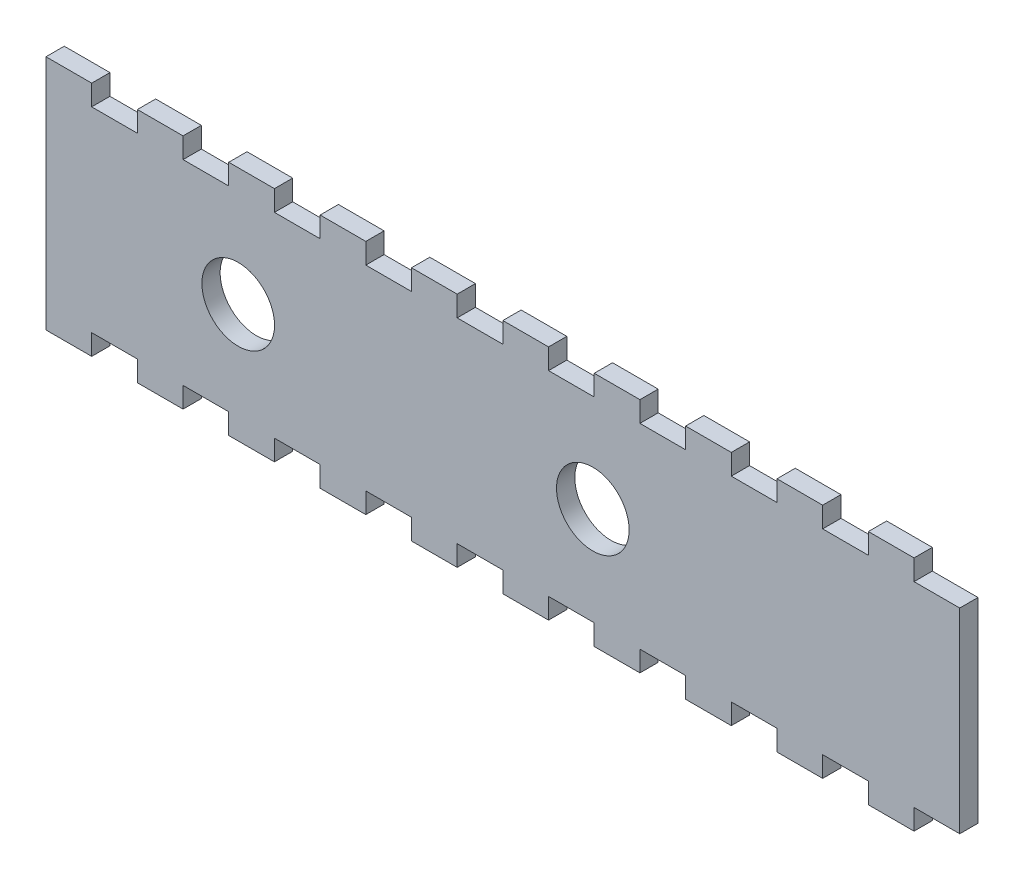
from build123d import *

# Parameters (mm, degrees)
SKETCH1_W           = 100
SKETCH1_H           = 21.4
SKETCH1_R           = 3.975
BOSS_EXTRUDE2_DEPTH = 2
SKETCH1_6_W         = 5
SKETCH1_6_H         = 2.25
BOSS_EXTRUDE4_DEPTH = 2


with BuildPart() as part:
    # Sketch1 → Boss-Extrude2 (new body)
    with BuildSketch(Plane.XY):
        with Locations((50, 10.7)):
            Rectangle(SKETCH1_W, SKETCH1_H)
        with Locations((59.844934973, 10.7)):
            Circle(SKETCH1_R, mode=Mode.SUBTRACT)
        with Locations((21.034934973, 10.7)):
            Circle(SKETCH1_R, mode=Mode.SUBTRACT)
    extrude(amount=BOSS_EXTRUDE2_DEPTH)

    # Sketch1<6> → Boss-Extrude4 (add)
    with BuildSketch(Plane.XY):
        with Locations((2.5, -1.125)):
            Rectangle(SKETCH1_6_W, SKETCH1_6_H)
        with Locations((2.5, 22.525)):
            Rectangle(SKETCH1_6_W, SKETCH1_6_H)
        with Locations((12.5, -1.125)):
            Rectangle(SKETCH1_6_W, SKETCH1_6_H)
        with Locations((12.5, 22.525)):
            Rectangle(SKETCH1_6_W, SKETCH1_6_H)
        with Locations((22.5, -1.125)):
            Rectangle(SKETCH1_6_W, SKETCH1_6_H)
        with Locations((22.5, 22.525)):
            Rectangle(SKETCH1_6_W, SKETCH1_6_H)
        with Locations((32.5, -1.125)):
            Rectangle(SKETCH1_6_W, SKETCH1_6_H)
        with Locations((32.5, 22.525)):
            Rectangle(SKETCH1_6_W, SKETCH1_6_H)
        with Locations((42.5, -1.125)):
            Rectangle(SKETCH1_6_W, SKETCH1_6_H)
        with Locations((42.5, 22.525)):
            Rectangle(SKETCH1_6_W, SKETCH1_6_H)
        with Locations((52.5, -1.125)):
            Rectangle(SKETCH1_6_W, SKETCH1_6_H)
        with Locations((52.5, 22.525)):
            Rectangle(SKETCH1_6_W, SKETCH1_6_H)
        with Locations((62.5, -1.125)):
            Rectangle(SKETCH1_6_W, SKETCH1_6_H)
        with Locations((62.5, 22.525)):
            Rectangle(SKETCH1_6_W, SKETCH1_6_H)
        with Locations((72.5, -1.125)):
            Rectangle(SKETCH1_6_W, SKETCH1_6_H)
        with Locations((72.5, 22.525)):
            Rectangle(SKETCH1_6_W, SKETCH1_6_H)
        with Locations((82.5, -1.125)):
            Rectangle(SKETCH1_6_W, SKETCH1_6_H)
        with Locations((82.5, 22.525)):
            Rectangle(SKETCH1_6_W, SKETCH1_6_H)
        with Locations((92.5, -1.125)):
            Rectangle(SKETCH1_6_W, SKETCH1_6_H)
        with Locations((92.5, 22.525)):
            Rectangle(SKETCH1_6_W, SKETCH1_6_H)
    extrude(amount=BOSS_EXTRUDE4_DEPTH)


solid = part.part
